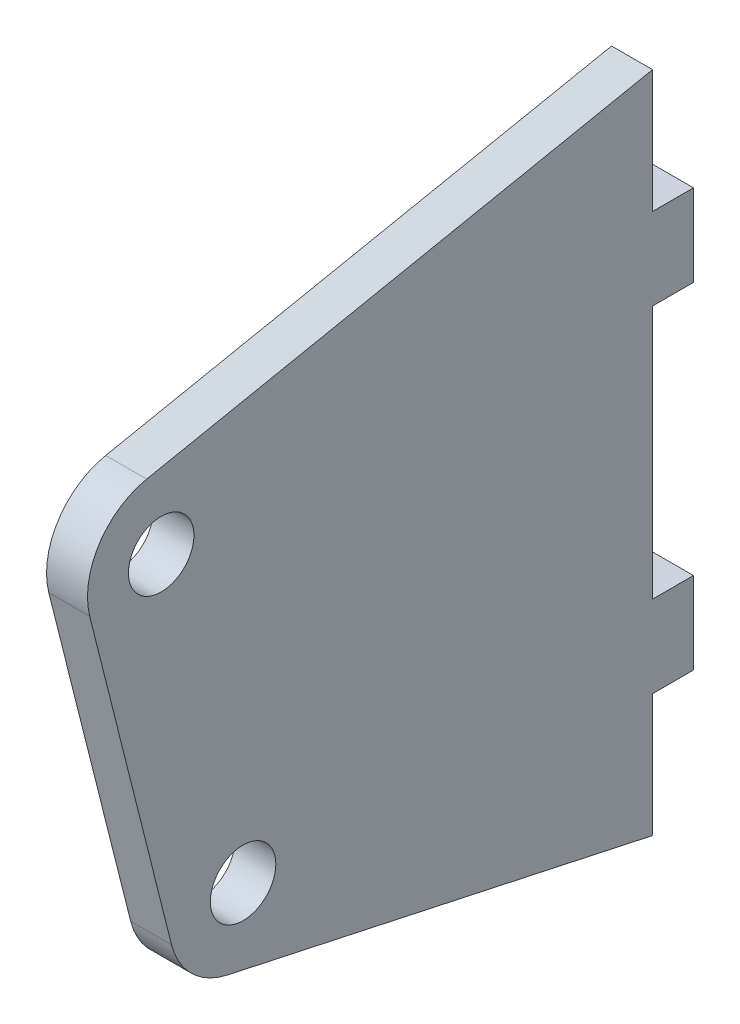
from build123d import *

# Parameters (mm, degrees)
SKETCH1_R           = 4
BOSS_EXTRUDE1_DEPTH = 2.5


with BuildPart() as part:
    # Sketch1 → Boss-Extrude1 (new, symmetric)
    with BuildSketch(Plane.YZ):
        with BuildLine():
            Line((-29.297384522, 51.898953809), (-40.5, 0))
            Line((-40.5, 0), (-25.5, 0))
            Line((-25.5, 0), (-25.5, -5))
            Line((-25.5, -5), (-15.5, -5))
            Line((-15.5, -5), (-15.5, 0))
            Line((-15.5, 0), (15.5, 0))
            Line((15.5, 0), (15.5, -5))
            Line((15.5, -5), (25.5, -5))
            Line((25.5, -5), (25.5, 0))
            Line((25.5, 0), (40.5, 0))
            Line((40.5, 0), (28.085365409, 61.773282105))
            ThreePointArc((28.085365409, 61.773282105), (24.06562356, 67.610728604), (17.066668753, 68.728197959))
            Line((17.066668753, 68.728197959), (-22.695121951, 58.728197959))
            ThreePointArc((-22.695121951, 58.728197959), (-26.970582938, 56.255522076), (-29.297384522, 51.898953809))
        make_face()
        with Locations(Location((-20.5, 50, 0), (0, 0, 270))):
            Circle(SKETCH1_R, mode=Mode.SUBTRACT)
        with Locations(Location((19.261790704, 60, 0), (0, 0, 270))):
            Circle(SKETCH1_R, mode=Mode.SUBTRACT)
    extrude(amount=BOSS_EXTRUDE1_DEPTH, both=True)


solid = part.part
